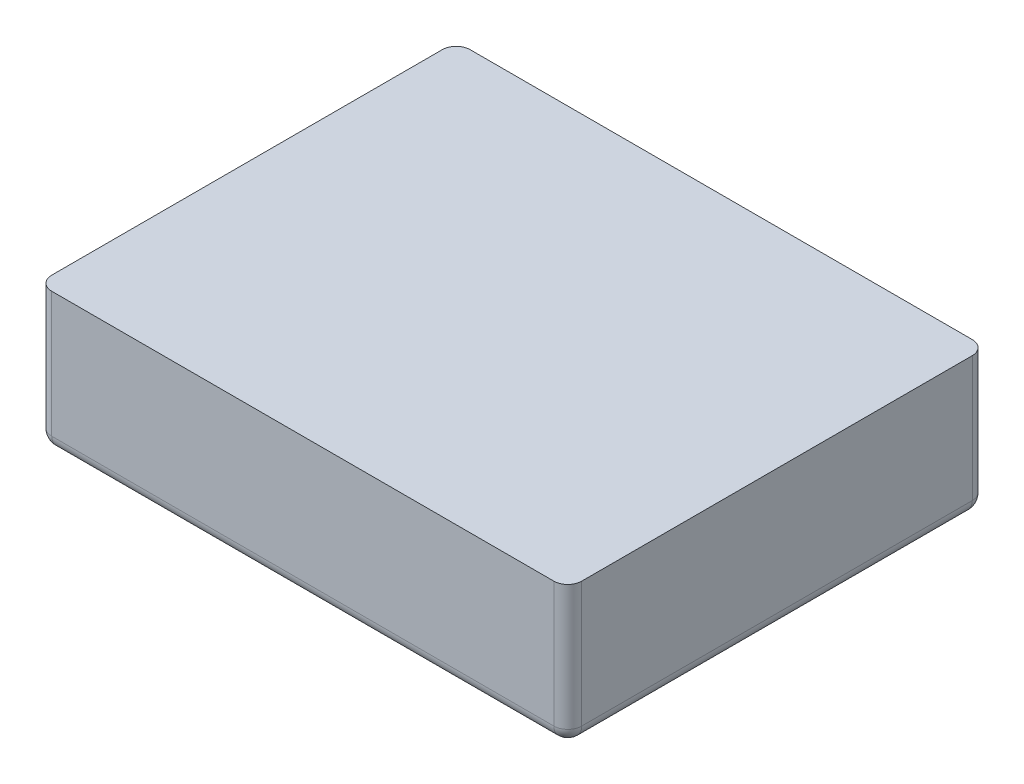
from build123d import *

# Parameters (mm, degrees)
SKETCH1_W           = 482.6
SKETCH1_H           = 381
BOSS_EXTRUDE1_DEPTH = 127
FILLET1_R           = 12.7


with BuildPart() as part:
    # Sketch1 → Boss-Extrude1 (new body)
    with BuildSketch(Plane(origin=(0, 0, 0), x_dir=(1, 0, 0), z_dir=(0, 1, 0))):
        with Locations((241.3, 190.5)):
            Rectangle(SKETCH1_W, SKETCH1_H)
    extrude(amount=-BOSS_EXTRUDE1_DEPTH)

    # Fillet1
    fillet1_edges = [part.edges().sort_by_distance(p)[0] for p in [
        (482.6, -127, -190.5),
        (241.3, -127, -381),
        (0, -127, -190.5),
        (241.3, -127, 0),
        (0, -63.5, -381),
        (482.6, -63.5, -381),
        (482.6, -63.5, 0),
        (0, -63.5, 0),
    ]]
    fillet(fillet1_edges, radius=FILLET1_R)


solid = part.part
